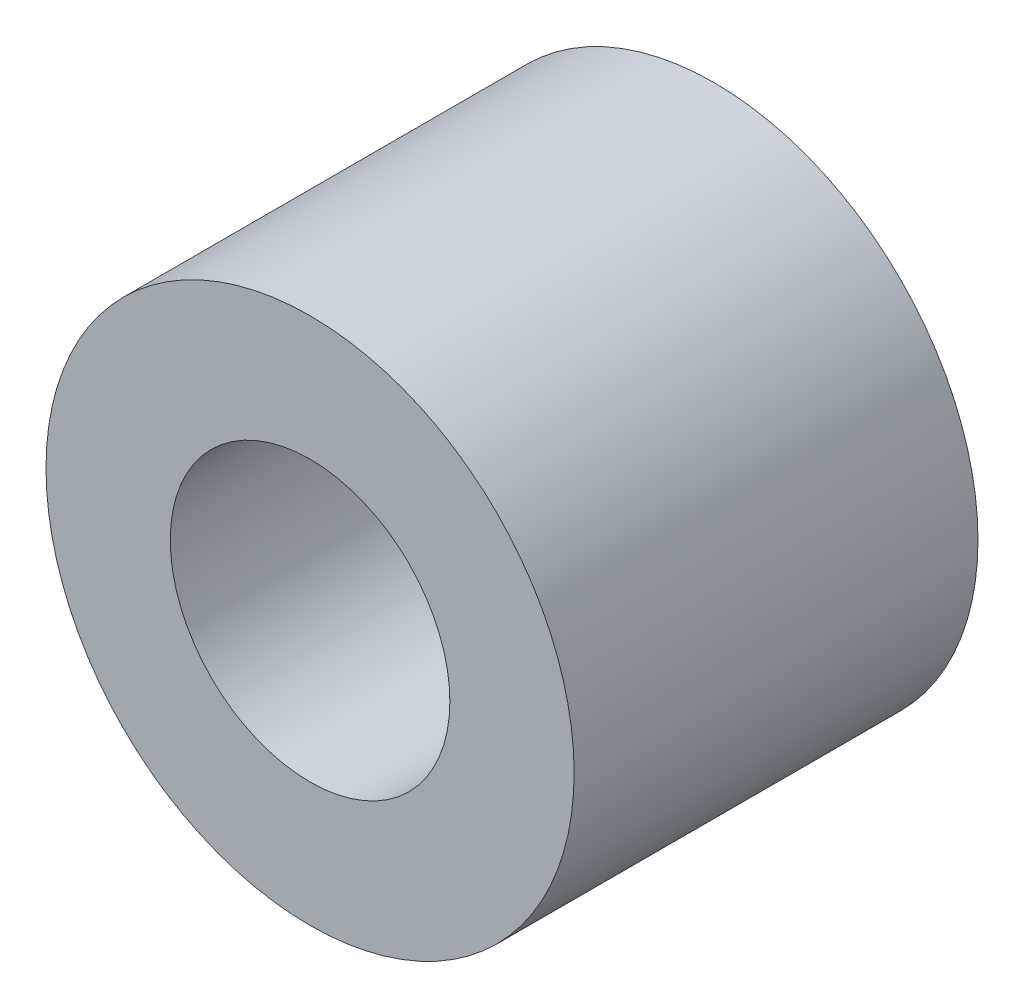
from build123d import *

# Parameters (mm, degrees)
ESBO_O2_R                = 8.5
RESSALTO_EXTRUS_O1_DEPTH = 13
ESBO_O3_R                = 4.5
CORTE_EXTRUS_O1_DEPTH    = 16


with BuildPart() as part:
    # Esboço2 → Ressalto-extrusão1 (new body)
    with BuildSketch(Plane.XY):
        with Locations(Location((0, 0, 0), (0, 0, 180))):
            Circle(ESBO_O2_R)
    extrude(amount=RESSALTO_EXTRUS_O1_DEPTH)

    # Esboço3 → Corte-extrusão1 (cut)
    with BuildSketch(Plane.XY.offset(13)):
        Circle(ESBO_O3_R)
    extrude(amount=-CORTE_EXTRUS_O1_DEPTH, mode=Mode.SUBTRACT)


solid = part.part
